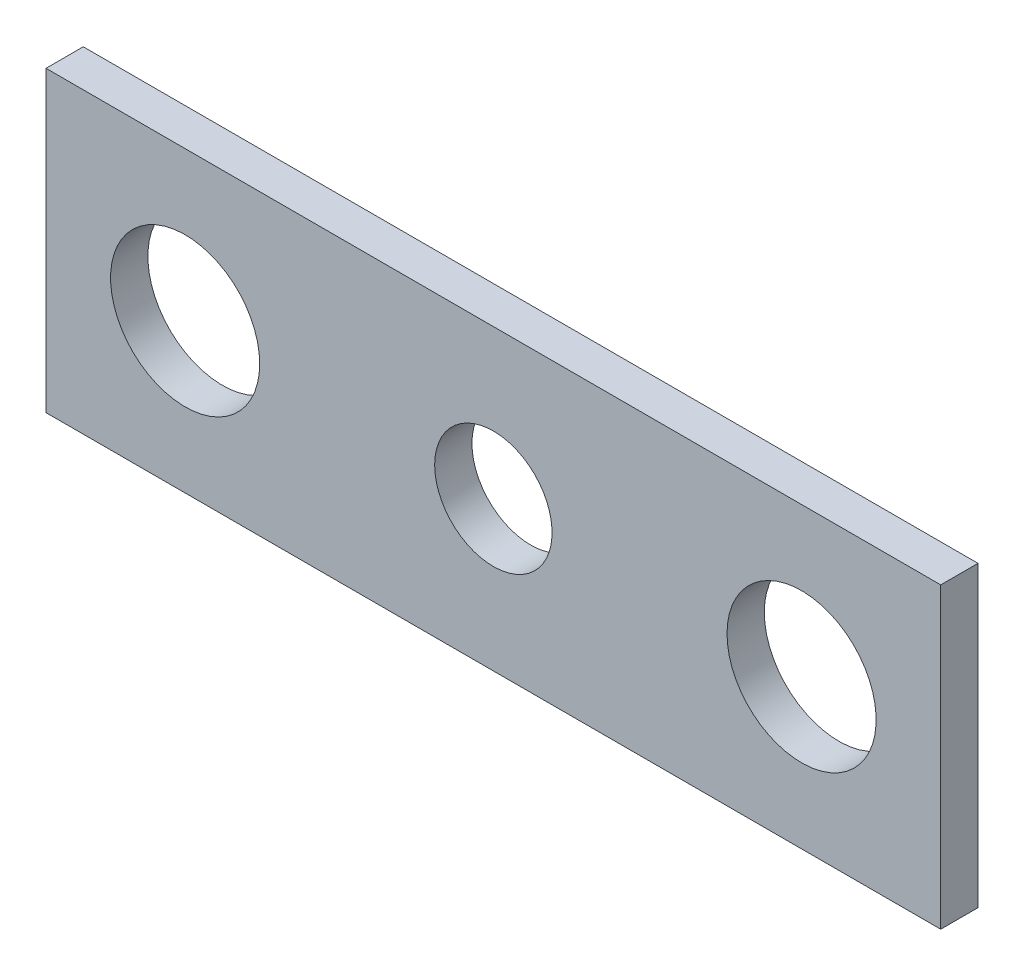
from build123d import *

# Parameters (mm, degrees)
SKETCH1_W           = 152.4
SKETCH1_H           = 50.8
BOSS_EXTRUDE1_DEPTH = 6.35
SKETCH2_R           = 12.7
SKETCH2_R_2         = 10
CUT_EXTRUDE1_DEPTH  = 6.35


with BuildPart() as part:
    # Sketch1 → Boss-Extrude1 (new body)
    with BuildSketch(Plane.XY):
        with Locations((-76.2, 25.4)):
            Rectangle(SKETCH1_W, SKETCH1_H)
    extrude(amount=BOSS_EXTRUDE1_DEPTH)

    # Sketch2 → Cut-Extrude1 (cut)
    with BuildSketch(Plane(origin=(0, 0, 0), x_dir=(-1, 0, 0), z_dir=(0, 0, -1))):
        with Locations((23.7, 25.4)):
            Circle(SKETCH2_R)
        with Locations((76.2, 25.4)):
            Circle(SKETCH2_R_2)
        with Locations(Location((128.7, 25.4, 0), (0, 0, 180))):
            Circle(SKETCH2_R)
    extrude(amount=-CUT_EXTRUDE1_DEPTH, mode=Mode.SUBTRACT)


solid = part.part
